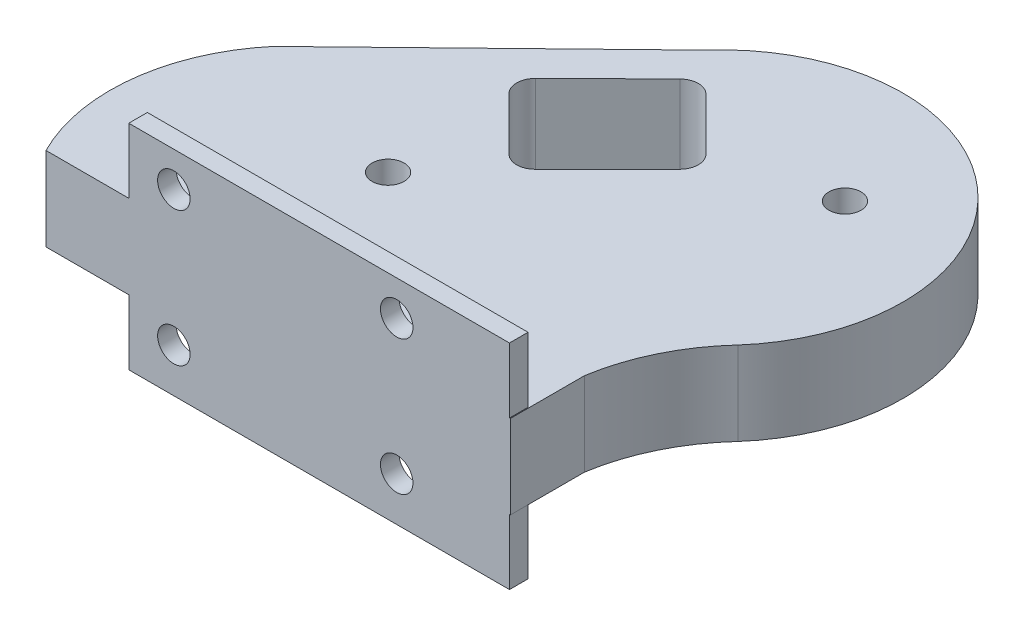
from build123d import *

# Parameters (mm, degrees)
BOSS_EXTRUDE1_DEPTH = 9
SKETCH2_W           = 41
SKETCH2_H           = 7
BOSS_EXTRUDE2_DEPTH = 2
SKETCH3_R           = 1.75
CUT_EXTRUDE1_DEPTH  = 2
SKETCH5_R           = 1.725
CUT_EXTRUDE4_DEPTH  = 9
CUT_EXTRUDE5_DEPTH  = 9
FILLET1_R           = 2


with BuildPart() as part:
    # Sketch1 → Boss-Extrude1 (new body)
    with BuildSketch(Plane(origin=(0, 0, 0), x_dir=(1, 0, 0), z_dir=(0, 1, 0))):
        with BuildLine():
            Line((0, 0), (50, 0))
            Line((50, 0), (50, 8))
            ThreePointArc((50, 8), (51.881677867, 13.952299325), (55.397568431, 19.110699502))
            ThreePointArc((55.397568431, 19.110699502), (53.716316301, 46.611180772), (26.21583503, 44.929928642))
            Line((26.21583503, 44.929928642), (2.535645118, 21.946269105))
            ThreePointArc((2.535645118, 21.946269105), (-2.034097015, 11.354634306), (0, 0))
        make_face()
    extrude(amount=BOSS_EXTRUDE1_DEPTH)

    # Sketch2 → Boss-Extrude2 (add)
    with BuildSketch(Plane.XY):
        with Locations((29.413010925, -3.5)):
            Rectangle(SKETCH2_W, SKETCH2_H)
        with Locations((29.413010925, 12.5)):
            Rectangle(SKETCH2_W, SKETCH2_H)
    extrude(amount=-BOSS_EXTRUDE2_DEPTH)

    # Sketch3 → Cut-Extrude1 (cut)
    with BuildSketch(Plane(origin=(0, 0, -2), x_dir=(-1, 0, 0), z_dir=(0, 0, -1))):
        with Locations((-13.769448398, -2.263474859)):
            Circle(SKETCH3_R)
        with Locations((-37.769448398, -2.263474859)):
            Circle(SKETCH3_R)
        with Locations((-37.769448398, 12.236525141)):
            Circle(SKETCH3_R)
        with Locations((-13.769448398, 12.236525141)):
            Circle(SKETCH3_R)
    extrude(amount=-CUT_EXTRUDE1_DEPTH, mode=Mode.SUBTRACT)

    # Sketch5 → Cut-Extrude4 (cut)
    with BuildSketch(Plane(origin=(0, 9, 0), x_dir=(1, 0, 0), z_dir=(0, 1, 0))):
        with Locations(Location((20.448484722, 16.392658608, 0), (0, 0, 270))):
            Circle(SKETCH5_R)
        with Locations(Location((47.74101634, 38.304247275, 0), (0, 0, 270))):
            Circle(SKETCH5_R)
    extrude(amount=-CUT_EXTRUDE4_DEPTH, mode=Mode.SUBTRACT)

    # Sketch6 → Cut-Extrude5 (cut)
    with BuildSketch(Plane(origin=(0, 9, 0), x_dir=(1, 0, 0), z_dir=(0, 1, 0))):
        Polygon((18.200821257, 31.659530408), (28.87624988, 42.196855672), (37.292479574, 33.780625977), (26.686102631, 23.174249034), align=None)
    extrude(amount=-CUT_EXTRUDE5_DEPTH, mode=Mode.SUBTRACT)

    # Fillet1
    fillet1_edges = [part.edges().sort_by_distance(p)[0] for p in [
        (18.200821257, 4.5, -31.659530408),
        (26.686102631, 4.5, -23.174249034),
        (37.292479574, 4.5, -33.780625977),
        (28.87624988, 4.5, -42.196855672),
    ]]
    fillet(fillet1_edges, radius=FILLET1_R)


solid = part.part
